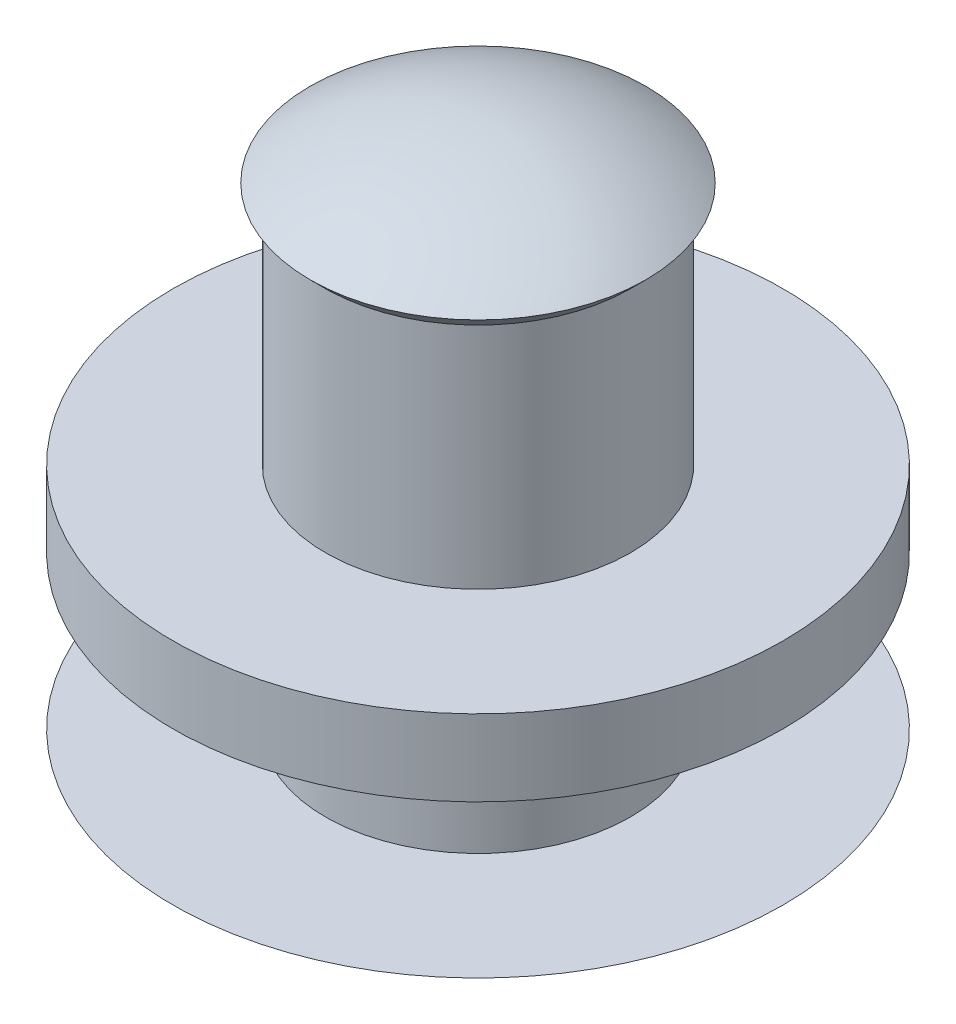
from build123d import *


with BuildPart() as part:
    # Sketch2 → Revolve7 (revolve)
    with BuildSketch(Plane.XY):
        with BuildLine():
            Line((0, -0.3), (0, 3.441648784))
            ThreePointArc((0, 3.441648784), (0.575917505, 3.354270484), (1.1, 3.1))
            Line((1.1, 3.1), (1, 3))
            Line((1, 3), (1, 1.5))
            Line((1, 1.5), (2, 1.5))
            Line((2, 1.5), (2, 1))
            Line((2, 1), (1, 1))
            Line((1, 1), (1, 0))
            Line((1, 0), (2, 0))
            ThreePointArc((2, 0), (1.011187421, -0.224582805), (0, -0.3))
        make_face()
    revolve(axis=Axis((0, -0.3, 0), (0, 1, 0)))


solid = part.part
